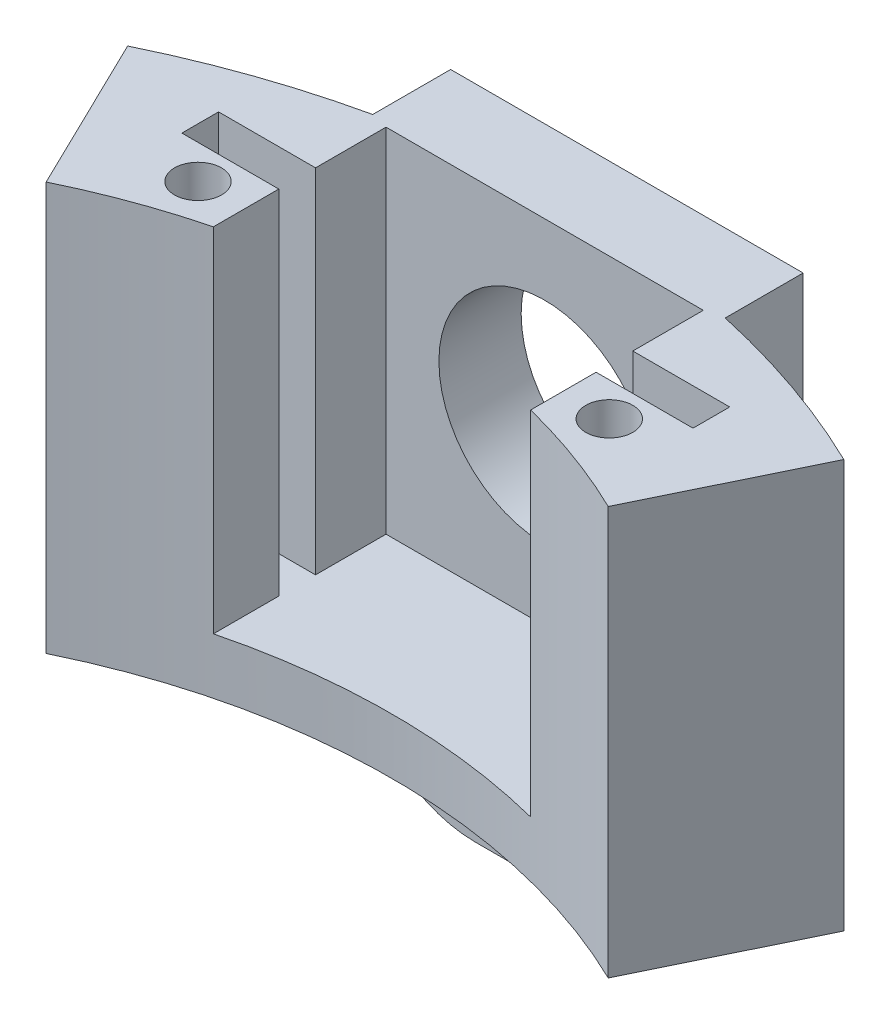
from build123d import *

# Parameters (mm, degrees)
BOSS_EXTRUDE1_DEPTH = 34.75
SKETCH2_R           = 2
CUT_EXTRUDE1_DEPTH  = 72.445179815
SKETCH3_W           = 30
SKETCH3_H           = 7.896551268
BOSS_EXTRUDE2_DEPTH = 48
SKETCH4_W           = 30
SKETCH4_H           = 6
CUT_EXTRUDE2_DEPTH  = 4
FILLET1_R           = 10
SKETCH5_R           = 9
CUT_EXTRUDE3_DEPTH  = 75.652167363
BOSS_EXTRUDE3_DEPTH = 1
CUT_EXTRUDE4_DEPTH  = 0.5
CUT_EXTRUDE5_START  = -30
CUT_EXTRUDE5_DEPTH  = 30
SKETCH11_W          = 8.25
SKETCH11_H          = 3.125
CUT_EXTRUDE6_DEPTH  = 30


with BuildPart() as part:
    # Sketch1 → Boss-Extrude1 (new body)
    with BuildSketch(Plane(origin=(0, 0, 0), x_dir=(1, 0, 0), z_dir=(0, 1, 0))):
        with BuildLine():
            Line((0, 0), (6.55816832, -13.490382807))
            ThreePointArc((6.55816832, -13.490382807), (30.474828919, -7.985034321), (54.391489518, -13.490382807))
            Line((54.391489518, -13.490382807), (60.949657838, 0))
            ThreePointArc((60.949657838, 0), (30.474828919, 7.014965679), (0, 0))
        make_face()
    extrude(amount=BOSS_EXTRUDE1_DEPTH)

    # Sketch2 → Cut-Extrude1 (cut, through all)
    with BuildSketch(Plane(origin=(0, 34.75, 0), x_dir=(1, 0, 0), z_dir=(0, 1, 0))):
        with Locations(Location((12.974828919, -6.985034321, 0), (0, 0, 270))):
            Circle(SKETCH2_R)
        with Locations(Location((47.974828919, -6.985034321, 0), (0, 0, 90))):
            Circle(SKETCH2_R)
    extrude(amount=-CUT_EXTRUDE1_DEPTH, mode=Mode.SUBTRACT)

    # Sketch3 → Boss-Extrude2 (add)
    with BuildSketch(Plane(origin=(0, 34.75, 0), x_dir=(1, 0, 0), z_dir=(0, 1, 0))):
        with Locations((30.474828919, 8.066690045)):
            Rectangle(SKETCH3_W, SKETCH3_H)
    extrude(amount=-BOSS_EXTRUDE2_DEPTH)

    # Sketch4 → Cut-Extrude2 (cut)
    with BuildSketch(Plane.XY.offset(-4.118414411)):
        with Locations((30.474828919, -3)):
            Rectangle(SKETCH4_W, SKETCH4_H)
    extrude(amount=-CUT_EXTRUDE2_DEPTH, mode=Mode.SUBTRACT)

    # Fillet1
    fillet1_edges = [part.edges().sort_by_distance(p)[0] for p in [
        (15.474828919, -13.25, -8.066690045),
        (45.474828919, -13.25, -8.066690045),
    ]]
    fillet(fillet1_edges, radius=FILLET1_R)

    # Sketch5 → Cut-Extrude3 (cut, through all)
    with BuildSketch(Plane(origin=(0, 0, -12.014965679), x_dir=(-1, 0, 0), z_dir=(0, 0, -1))):
        with Locations((-30.474828919, 19.75)):
            Circle(SKETCH5_R)
    extrude(amount=-CUT_EXTRUDE3_DEPTH, mode=Mode.SUBTRACT)

    # Sketch7 → Boss-Extrude3 (add)
    with BuildSketch(Plane(origin=(0, 0, -12.014965679), x_dir=(-1, 0, 0), z_dir=(0, 0, -1))):
        with BuildLine():
            Line((-21.536068007, 1.453872129), (-26.199769352, 0))
            ThreePointArc((-26.199769352, 0), (-24.751375622, 3.560871216), (-21.536068007, 1.453872129))
        make_face()
        with BuildLine():
            Line((-34.426020337, 3.673663851), (-38.960174422, 5.664158065))
            ThreePointArc((-38.960174422, 5.664158065), (-37.895872331, 1.929105477), (-34.426020337, 3.673663851))
        make_face()
    extrude(amount=BOSS_EXTRUDE3_DEPTH)

    # Sketch8 → Cut-Extrude4 (cut)
    with BuildSketch(Plane(origin=(0, 0, -13.014965679), x_dir=(-1, 0, 0), z_dir=(0, 0, -1))):
        with BuildLine():
            Line((-23.022731531, 0.990416495), (-25.036897729, 0.362516061))
            ThreePointArc((-25.036897729, 0.362516061), (-24.475304572, 2.105499822), (-23.022731531, 0.990416495))
        make_face()
        with BuildLine():
            Line((-35.750767501, 4.255228023), (-37.89390211, 5.196064386))
            ThreePointArc((-37.89390211, 5.196064386), (-37.451768412, 3.29185708), (-35.750767501, 4.255228023))
        make_face()
    extrude(amount=-CUT_EXTRUDE4_DEPTH, mode=Mode.SUBTRACT)

    # Sketch9 → Cut-Extrude5 (cut)
    with BuildSketch(Plane(origin=(0, 34.75, 0), x_dir=(1, 0, 0), z_dir=(0, 1, 0)).offset(CUT_EXTRUDE5_START)):
        with BuildLine():
            Line((30.474828919, 5.014965679), (30.474828919, -7.985034321))
            ThreePointArc((30.474828919, -7.985034321), (37.27763759, -8.409679524), (43.974828919, -9.677022281))
            Line((43.974828919, -9.677022281), (43.974828919, 5.014965679))
            Line((43.974828919, 5.014965679), (30.474828919, 5.014965679))
        make_face()
        with BuildLine():
            ThreePointArc((16.974828919, -9.677022281), (23.672020248, -8.409679524), (30.474828919, -7.985034321))
            Line((30.474828919, -7.985034321), (30.474828919, 5.014965679))
            Line((30.474828919, 5.014965679), (16.974828919, 5.014965679))
            Line((16.974828919, 5.014965679), (16.974828919, -9.677022281))
        make_face()
    extrude(amount=CUT_EXTRUDE5_DEPTH, mode=Mode.SUBTRACT)

    # Sketch11 → Cut-Extrude6 (cut)
    with BuildSketch(Plane(origin=(0, 34.75, 0), x_dir=(1, 0, 0), z_dir=(0, 1, 0))):
        with Locations((12.849828919, -2.547534321)):
            Rectangle(SKETCH11_W, SKETCH11_H)
        with Locations((48.099828919, -2.547534321)):
            Rectangle(SKETCH11_W, SKETCH11_H)
    extrude(amount=-CUT_EXTRUDE6_DEPTH, mode=Mode.SUBTRACT)


solid = part.part
